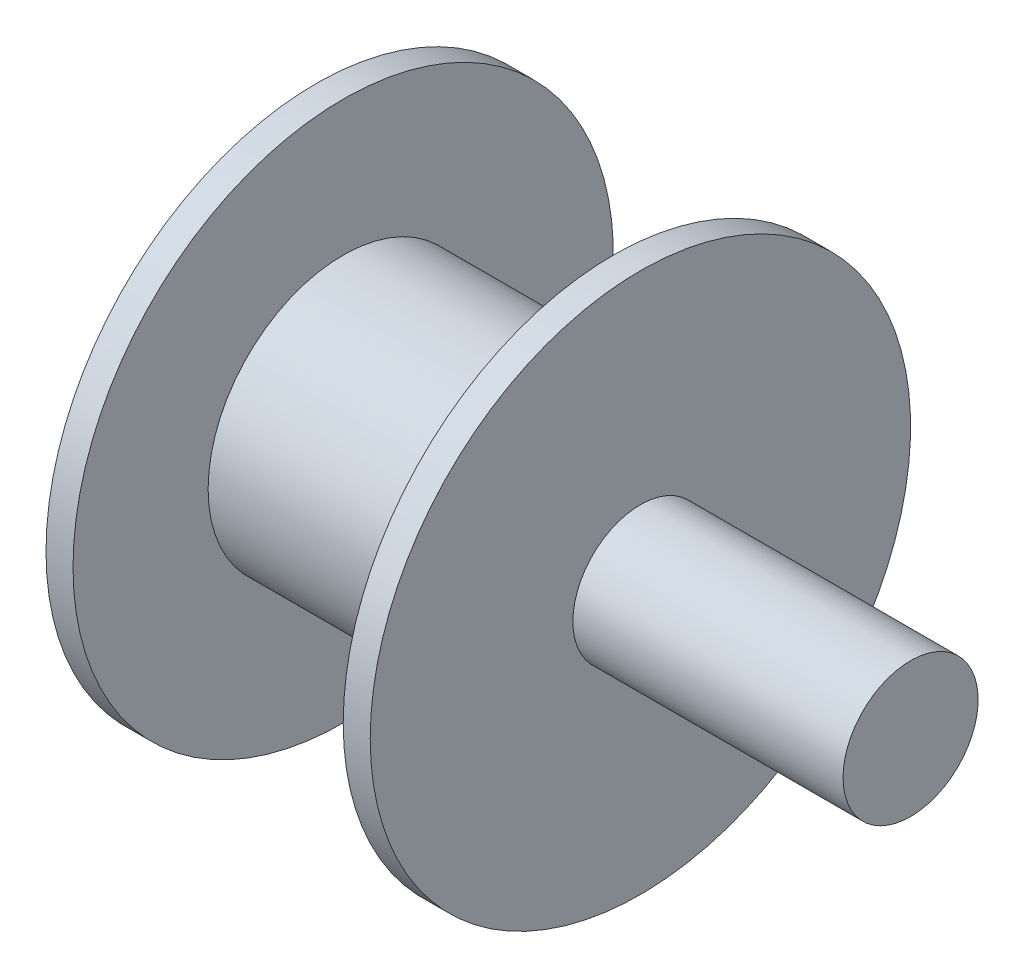
from build123d import *


with BuildPart() as part:
    # Sketch1 → Revolve1 (revolve)
    with BuildSketch(Plane.XY, mode=Mode.PRIVATE) as revolve1_sk:
        Polygon((-50.948509485, 0), (-50.948509485, 20), (-48.948509485, 20), (-48.948509485, 10), (-28.948509485, 10), (-28.948509485, 20), (-26.948509485, 20), (-26.948509485, 5), (-6.948509485, 5), (-6.948509485, 0), align=None)
    revolve(revolve1_sk.sketch.rotate(Axis((-571.787663179, 0, 0), (1, 0, 0)), 90), axis=Axis((-571.787663179, 0, 0), (1, 0, 0)))


solid = part.part
